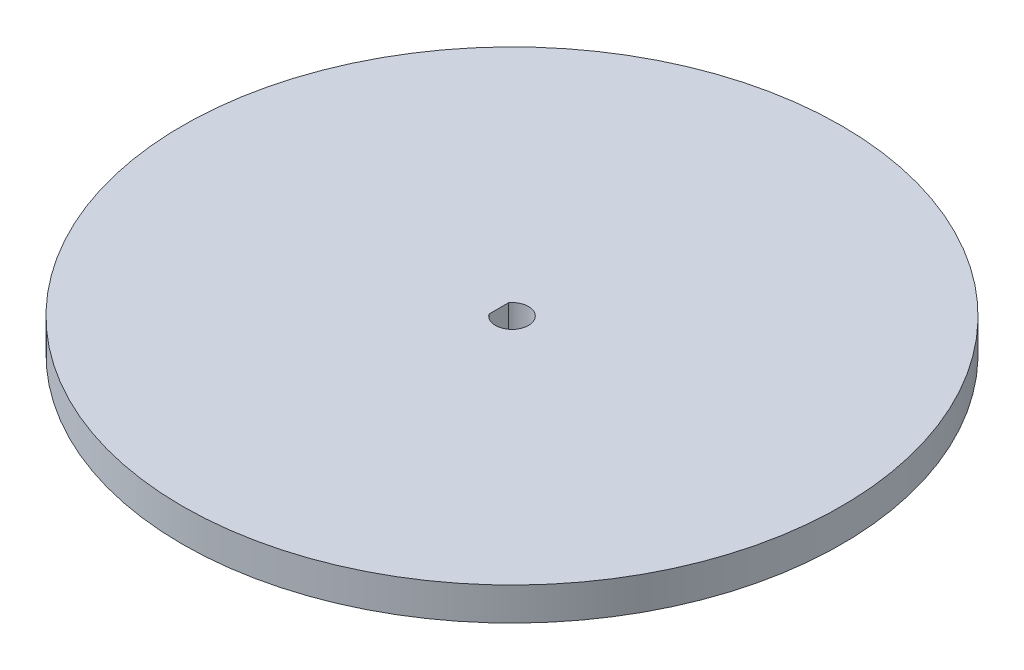
from build123d import *

# Parameters (mm, degrees)
SKETCH_1_R      = 100
EXTRUDE_1_DEPTH = 10


with BuildPart() as part:
    # 草图1 → 凸台-拉伸1 (new body)
    with BuildSketch(Plane(origin=(0, 0, 0), x_dir=(1, 0, 0), z_dir=(0, 1, 0))):
        with Locations(Location((0, 0, 0), (0, 0, 270))):
            Circle(SKETCH_1_R)
        with BuildLine():
            Line((-4, 3), (-4, -3))
            ThreePointArc((-4, -3), (5, 0), (-4, 3))
        make_face(mode=Mode.SUBTRACT)
    extrude(amount=EXTRUDE_1_DEPTH)


solid = part.part
